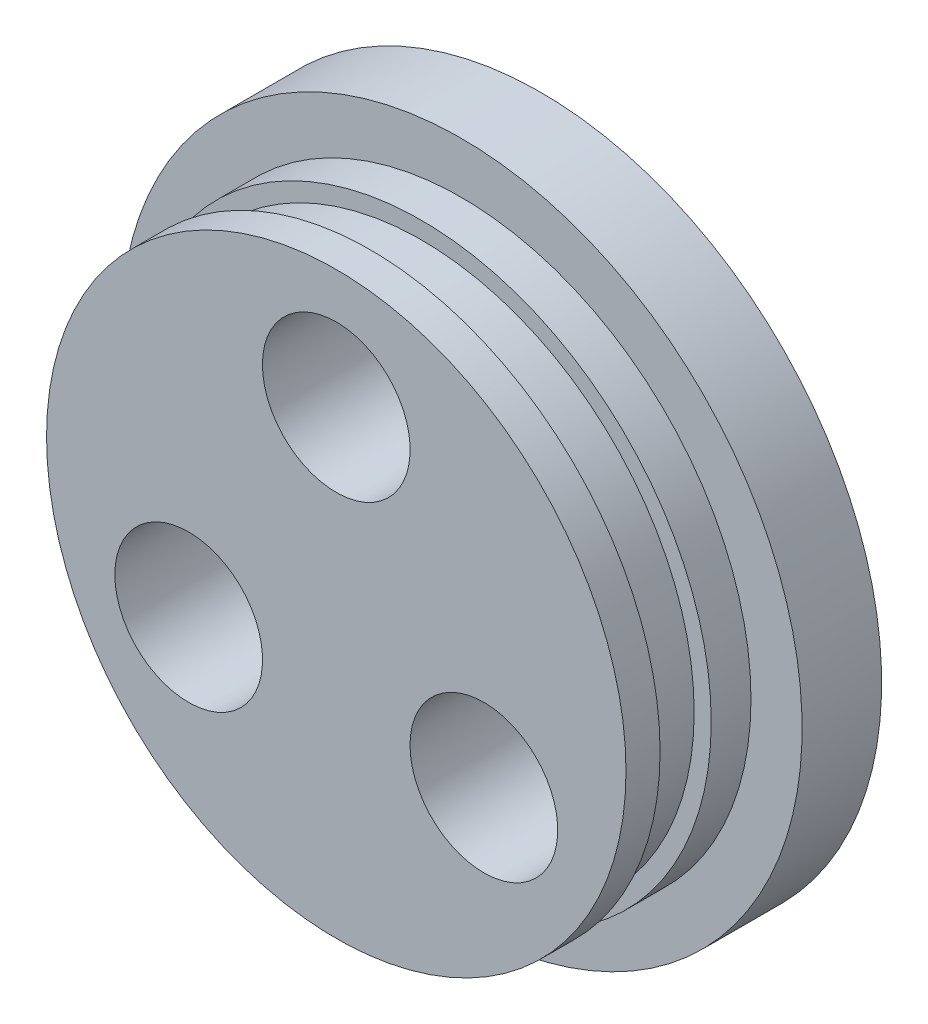
from build123d import *

# Parameters (mm, degrees)
SKETCH1_R           = 25.5
BOSS_EXTRUDE1_DEPTH = 11
SKETCH2_R           = 30
BOSS_EXTRUDE2_DEPTH = 7
SKETCH3_R           = 37.476082354
SKETCH3_R_2         = 24
CUT_EXTRUDE1_DEPTH  = 4.5
SKETCH5_R           = 6.5
CUT_EXTRUDE2_DEPTH  = 30.5


with BuildPart() as part:
    # Sketch1 → Boss-Extrude1 (new body)
    with BuildSketch(Plane.XY):
        Circle(SKETCH1_R)
    extrude(amount=BOSS_EXTRUDE1_DEPTH)

    # Sketch2 → Boss-Extrude2 (add)
    with BuildSketch(Plane(origin=(0, 0, 0), x_dir=(-1, 0, 0), z_dir=(0, 0, -1))):
        Circle(SKETCH2_R)
    extrude(amount=BOSS_EXTRUDE2_DEPTH)

    # Sketch3 → Cut-Extrude1 (cut)
    with BuildSketch(Plane.XY.offset(8)):
        Circle(SKETCH3_R)
        Circle(SKETCH3_R_2, mode=Mode.SUBTRACT)
    extrude(amount=-CUT_EXTRUDE1_DEPTH, mode=Mode.SUBTRACT)

    # Sketch5 → Cut-Extrude2 (cut)
    with BuildSketch(Plane(origin=(0, 0, -7), x_dir=(-1, 0, 0), z_dir=(0, 0, -1))):
        with Locations((0, 15)):
            Circle(SKETCH5_R)
        with Locations((-12.990381057, -7.5)):
            Circle(SKETCH5_R)
        with Locations((12.990381057, -7.5)):
            Circle(SKETCH5_R)
    extrude(amount=-CUT_EXTRUDE2_DEPTH, mode=Mode.SUBTRACT)


solid = part.part
